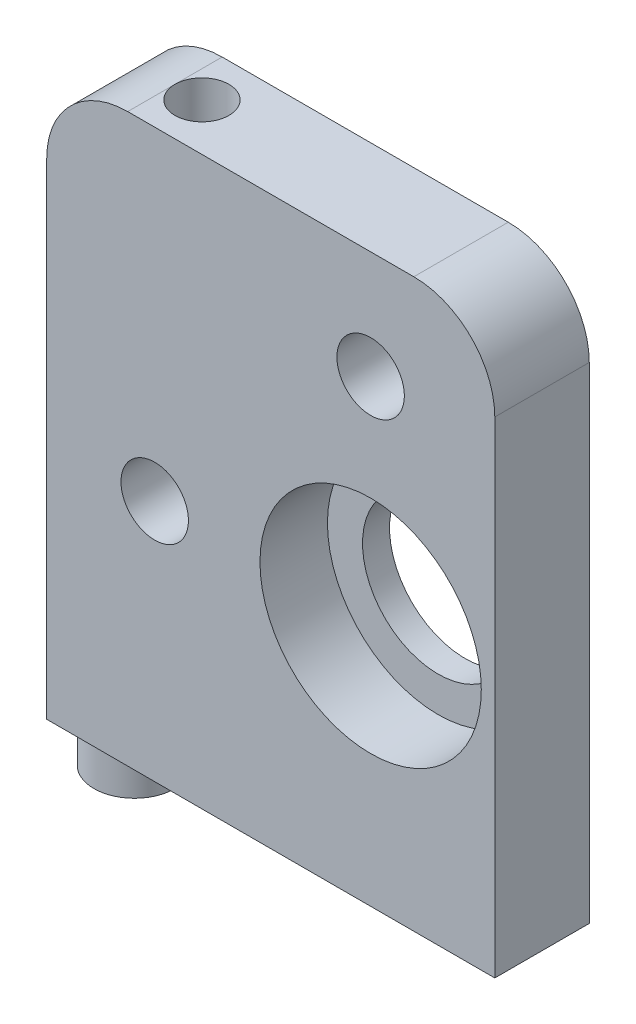
from build123d import *

# Parameters (mm, degrees)
SKETCH_1_W          = 16.6
SKETCH_1_H          = 21
SKETCH_1_R          = 1.25
SKETCH_1_R_2        = 4.1
EXTRUDE_1_DEPTH     = 3.5
SKETCH_1_3_R        = 4.1
SKETCH_1_3_R_2      = 2.8
EXTRUDE_2_DEPTH     = 1
FILLET_1_R          = 3
FILLET_2_R          = 3
SKETCH_2_R          = 1
CUT_EXTRUDE_1_DEPTH = 6
SKETCH_2_3_R        = 1.5
EXTRUDE_3_DEPTH     = 1.6
SKETCH_3_R          = 1
CUT_EXTRUDE_2_DEPTH = 6


with BuildPart() as part:
    # 草图1 → 凸台-拉伸1 (new body)
    with BuildSketch(Plane.XY):
        with Locations((-3.7, 1.5)):
            Rectangle(SKETCH_1_W, SKETCH_1_H)
        with Locations((-8, 0)):
            Circle(SKETCH_1_R, mode=Mode.SUBTRACT)
        Circle(SKETCH_1_R_2, mode=Mode.SUBTRACT)
        with Locations((0, 8)):
            Circle(SKETCH_1_R, mode=Mode.SUBTRACT)
    extrude(amount=EXTRUDE_1_DEPTH)

    # 草图1<3> → 凸台-拉伸2 (add)
    with BuildSketch(Plane.XY):
        Circle(SKETCH_1_3_R)
        Circle(SKETCH_1_3_R_2, mode=Mode.SUBTRACT)
    extrude(amount=EXTRUDE_2_DEPTH)

    # 圆角1
    fillet_1_edges = [part.edges().sort_by_distance(p)[0] for p in [
        (-12, 12, 1.75),
    ]]
    fillet(fillet_1_edges, radius=FILLET_1_R)

    # 圆角2
    fillet_2_edges = [part.edges().sort_by_distance(p)[0] for p in [
        (4.6, 12, 1.75),
    ]]
    fillet(fillet_2_edges, radius=FILLET_2_R)

    # 草图2 → 切除-拉伸1 (cut)
    with BuildSketch(Plane.XZ.offset(9)):
        with Locations((-4.5, 1.75)):
            Circle(SKETCH_2_R)
    extrude(amount=-CUT_EXTRUDE_1_DEPTH, mode=Mode.SUBTRACT)

    # 草图2<3> → 凸台-拉伸3 (add)
    with BuildSketch(Plane.XZ.offset(9)):
        with Locations((-10.5, 1.75)):
            Circle(SKETCH_2_3_R)
    extrude(amount=EXTRUDE_3_DEPTH)

    # 草图3 → 切除-拉伸2 (cut)
    with BuildSketch(Plane(origin=(0, 12, 0), x_dir=(1, 0, 0), z_dir=(0, 1, 0))):
        with Locations((-8, -1.75)):
            Circle(SKETCH_3_R)
    extrude(amount=-CUT_EXTRUDE_2_DEPTH, mode=Mode.SUBTRACT)


solid = part.part
